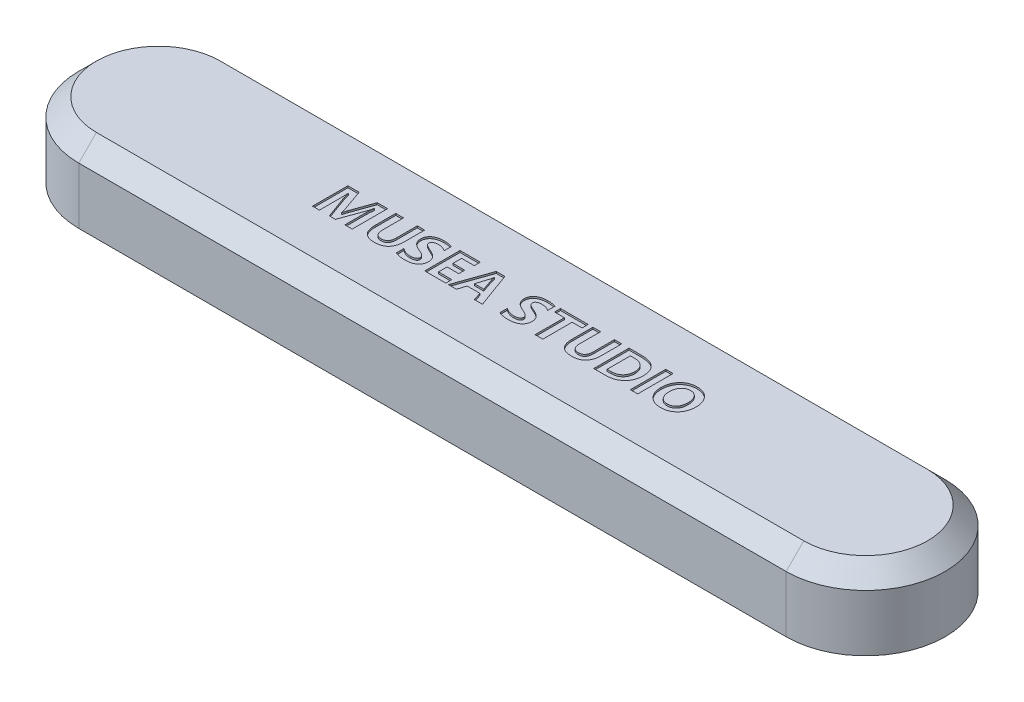
from build123d import *

# Parameters (mm, degrees)
EXTRUDE_1_DEPTH     = 21
CHAMFER_1_SIZE      = 5
SHELL_1_T           = -2.5
CUT_EXTRUDE_2_DEPTH = 1.2
SKETCH_4_R          = 5
EXTRUDE_3_DEPTH     = 17.5
SKETCH_5_R          = 1.6
CUT_EXTRUDE_3_DEPTH = 10
CUT_EXTRUDE_4_DEPTH = 2.4
SKETCH_7_W          = 2.073170732
SKETCH_7_H          = 10
CUT_EXTRUDE_5_DEPTH = 0.5


with BuildPart() as part:
    # 草图1 → 凸台-拉伸1 (new body)
    with BuildSketch(Plane(origin=(0, 0, 0), x_dir=(1, 0, 0), z_dir=(0, 1, 0))):
        with BuildLine():
            ThreePointArc((-77.5, 0), (-84.090097423, 15.909902577), (-100, 22.5))
            Line((-100, 22.5), (-100, -22.5))
            ThreePointArc((-100, -22.5), (-84.090097423, -15.909902577), (-77.5, 0))
        make_face()
        with BuildLine():
            Line((-100, -22.5), (-100, 22.5))
            ThreePointArc((-100, 22.5), (-122.5, 0), (-100, -22.5))
        make_face()
        with BuildLine():
            Line((100, 22.5), (-100, 22.5))
            ThreePointArc((-100, 22.5), (-84.090097423, 15.909902577), (-77.5, 0))
            ThreePointArc((-77.5, 0), (-84.090097423, -15.909902577), (-100, -22.5))
            Line((-100, -22.5), (100, -22.5))
            ThreePointArc((100, -22.5), (77.5, 0), (100, 22.5))
        make_face()
        with BuildLine():
            ThreePointArc((122.5, 0), (115.909902577, 15.909902577), (100, 22.5))
            Line((100, 22.5), (100, -22.5))
            ThreePointArc((100, -22.5), (115.909902577, -15.909902577), (122.5, 0))
        make_face()
        with BuildLine():
            Line((100, -22.5), (100, 22.5))
            ThreePointArc((100, 22.5), (77.5, 0), (100, -22.5))
        make_face()
    extrude(amount=EXTRUDE_1_DEPTH)

    # 倒角1
    chamfer_1_edges = [part.edges().sort_by_distance(p)[0] for p in [
        (0, 21, 22.5),
        (122.5, 21, 0),
        (0, 21, -22.5),
        (-122.5, 21, 0),
    ]]
    chamfer(chamfer_1_edges, length=CHAMFER_1_SIZE)

    # 抽壳1
    shell_1_openings = [part.faces().sort_by_distance(p)[0] for p in [
        (0, 0, 0),
    ]]
    offset(amount=SHELL_1_T, openings=shell_1_openings, kind=Kind.INTERSECTION)

    # 草图2 → 切除-拉伸2 (cut)
    with BuildSketch(Plane.XZ):
        with BuildLine():
            Line((-100, -21.2), (100, -21.2))
            ThreePointArc((100, -21.2), (121.2, 0), (100, 21.2))
            Line((100, 21.2), (-100, 21.2))
            ThreePointArc((-100, 21.2), (-121.2, 0), (-100, -21.2))
        make_face()
        with BuildLine():
            Line((-100, -20), (100, -20))
            ThreePointArc((100, -20), (120, 0), (100, 20))
            Line((100, 20), (-100, 20))
            ThreePointArc((-100, 20), (-120, 0), (-100, -20))
        make_face(mode=Mode.SUBTRACT)
    extrude(amount=-CUT_EXTRUDE_2_DEPTH, mode=Mode.SUBTRACT)

    # 草图4 → 凸台-拉伸3 (add)
    with BuildSketch(Plane.XZ.offset(-18.5)):
        with Locations(Location((-15, 0, 0), (0, 0, 90))):
            Circle(SKETCH_4_R)
    extrude_3 = extrude(amount=EXTRUDE_3_DEPTH)

    # 草图5 → 切除-拉伸3 (cut)
    with BuildSketch(Plane.XZ.offset(-1)):
        with Locations(Location((-15, 0, 0), (0, 0, 270))):
            Circle(SKETCH_5_R)
    cut_extrude_3 = extrude(amount=-CUT_EXTRUDE_3_DEPTH, mode=Mode.SUBTRACT)

    # 草图6 → 切除-拉伸4 (cut)
    with BuildSketch(Plane.XZ.offset(-1)):
        Polygon((-13.41228676, -2.75), (-11.824573519, 0), (-13.41228676, 2.75), (-16.58771324, 2.75), (-18.175426481, 0), (-16.58771324, -2.75), align=None)
    cut_extrude_4 = extrude(amount=-CUT_EXTRUDE_4_DEPTH, mode=Mode.SUBTRACT)

    # 镜向1: 凸台-拉伸3, 切除-拉伸3, 切除-拉伸4 across plane
    add(extrude_3.mirror(Plane(origin=(0, 0, 0), x_dir=(0, 0, 1), z_dir=(1, 0, 0))))
    add(cut_extrude_3.mirror(Plane(origin=(0, 0, 0), x_dir=(0, 0, 1), z_dir=(1, 0, 0))), mode=Mode.SUBTRACT)
    add(cut_extrude_4.mirror(Plane(origin=(0, 0, 0), x_dir=(0, 0, 1), z_dir=(1, 0, 0))), mode=Mode.SUBTRACT)

    # 草图7 → 切除-拉伸5 (cut)
    # profile 1 of 11: a face of its own
    with BuildSketch(Plane(origin=(0, 21, 0), x_dir=(1, 0, 0), z_dir=(0, 1, 0))):
        with BuildLine():
            add(Edge.make_bspline(
                [(42.256097561, -0.127667683), (42.259749856, 0.061814138), (42.266905329, 0.433041649), (42.333957619, 0.976034675), (42.439013879, 1.493063365), (42.59012681, 1.982386617), (42.782871829, 2.445125951), (43.020775656, 2.879390033), (43.300167685, 3.288002832), (43.621581842, 3.665187503), (43.976353468, 4.008421608), (44.362684535, 4.307410381), (44.778168763, 4.558595743), (45.220077779, 4.765245066), (45.689742506, 4.925719877), (46.18649449, 5.039497786), (46.71102865, 5.109609018), (47.070406662, 5.117775098), (47.254192073, 5.12195122)],
                knots=[0, 0, 0, 0, 1.114768385, 2.184023191, 3.214842008, 4.216375225, 5.193220596, 6.16016609, 7.125520499, 8.10150713, 9.071799814, 10.025905719, 10.970272928, 11.923536258, 12.891752738, 13.885610077, 14.918703956, 16, 16, 16, 16], degree=3))
            add(Edge.make_bspline(
                [(47.254192073, 5.12195122), (47.428416773, 5.117379621), (47.769841981, 5.108420736), (48.269216335, 5.043499514), (48.742199496, 4.932853645), (49.189974707, 4.778439305), (49.610269161, 4.576863579), (50.006408474, 4.334078703), (50.373713776, 4.04399496), (50.711270414, 3.712433641), (51.017308469, 3.348686487), (51.283386047, 2.955510209), (51.509736704, 2.537615937), (51.694901814, 2.093997687), (51.83818766, 1.624799963), (51.937859146, 1.13081746), (52.000498199, 0.611999646), (52.008239143, 0.257423987), (52.012195122, 0.076219512)],
                knots=[0, 0, 0, 0, 1.072352965, 2.101472042, 3.093497841, 4.057995957, 5.011133745, 5.957349481, 6.91241005, 7.885665393, 8.865378779, 9.833799821, 10.803025627, 11.786228153, 12.788045293, 13.817877169, 14.884834838, 16, 16, 16, 16], degree=3))
            add(Edge.make_bspline(
                [(52.012195122, 0.076219512), (52.008619575, -0.112639747), (52.001626822, -0.481994809), (51.933776686, -1.021556354), (51.831565081, -1.534389264), (51.681621775, -2.020005313), (51.48932019, -2.478547788), (51.25332629, -2.909950675), (50.976131456, -3.313889066), (50.658258913, -3.686351347), (50.306773259, -4.023165742), (49.926179342, -4.318761648), (49.518151304, -4.567527994), (49.083581685, -4.771030507), (48.622978311, -4.929265444), (48.135762405, -5.041355834), (47.622589019, -5.109040274), (47.271550368, -5.117585812), (47.09222561, -5.12195122)],
                knots=[0, 0, 0, 0, 1.125525784, 2.201208718, 3.237291209, 4.239916505, 5.226012927, 6.197109501, 7.166668921, 8.141825765, 9.111444352, 10.064375446, 11.00938735, 11.954725487, 12.920015397, 13.907536101, 14.931084707, 16, 16, 16, 16], degree=3))
            add(Edge.make_bspline(
                [(47.09222561, -5.12195122), (46.917319123, -5.118440561), (46.573798537, -5.111545542), (46.071976172, -5.042156114), (45.594695604, -4.935317338), (45.143384136, -4.781286219), (44.716693783, -4.585222057), (44.315797995, -4.343017486), (43.940405834, -4.057264383), (43.593516908, -3.730510341), (43.279885543, -3.369905229), (43.006323556, -2.980546317), (42.771330118, -2.567481768), (42.583584167, -2.127017195), (42.435499727, -1.662636277), (42.331990668, -1.173049545), (42.267468695, -0.658484724), (42.259938743, -0.30697829), (42.256097561, -0.127667683)],
                knots=[0, 0, 0, 0, 1.074367157, 2.110083177, 3.10723923, 4.076300727, 5.035189706, 5.987852663, 6.948956014, 7.929336404, 8.911673334, 9.88099426, 10.849387208, 11.826872217, 12.818227126, 13.84036962, 14.89832846, 16, 16, 16, 16], degree=3))
        make_face()
        with BuildLine():
            add(Edge.make_bspline(
                [(44.451219512, -0.013338415), (44.453563652, -0.130905921), (44.458159699, -0.361415171), (44.489788102, -0.699261852), (44.547488092, -1.020100129), (44.625869995, -1.324521887), (44.723597269, -1.613847817), (44.848732811, -1.884747151), (44.99401803, -2.140297887), (45.16087021, -2.377263176), (45.345920544, -2.593290374), (45.552327996, -2.779594519), (45.773925653, -2.938469788), (46.011881655, -3.070110786), (46.268254932, -3.168411034), (46.539990783, -3.241938647), (46.829279947, -3.283269223), (47.02731446, -3.289501009), (47.128429878, -3.292682927)],
                knots=[0, 0, 0, 0, 1.184931797, 2.323241753, 3.415735217, 4.466896578, 5.489261642, 6.489009157, 7.469635635, 8.448254088, 9.405790831, 10.330339266, 11.243447342, 12.148780307, 13.062964896, 14.003988727, 14.980846772, 16, 16, 16, 16], degree=3))
            add(Edge.make_bspline(
                [(47.128429878, -3.292682927), (47.231485131, -3.290440285), (47.432779718, -3.286059803), (47.725738936, -3.242586114), (48.001286564, -3.174946437), (48.259883771, -3.078870884), (48.500373958, -2.954740078), (48.72399134, -2.803481778), (48.926608242, -2.621402255), (49.11332824, -2.416456549), (49.279136283, -2.186434329), (49.423673803, -1.936714362), (49.546506975, -1.668172257), (49.644889418, -1.380624029), (49.723438699, -1.074925116), (49.777796397, -0.750460673), (49.81050757, -0.407178731), (49.814844425, -0.172203738), (49.817073171, -0.051448171)],
                knots=[0, 0, 0, 0, 1.038721561, 2.028902171, 2.979739093, 3.895937291, 4.804150696, 5.703190911, 6.610748933, 7.544954394, 8.494430894, 9.464599871, 10.450689967, 11.467673243, 12.525730618, 13.630462428, 14.782275302, 16, 16, 16, 16], degree=3))
            add(Edge.make_bspline(
                [(49.817073171, -0.051448171), (49.814854863, 0.074386246), (49.810533812, 0.319499603), (49.777714566, 0.676618674), (49.724716166, 1.013469312), (49.651310607, 1.330552564), (49.55456798, 1.627504218), (49.432981873, 1.902574323), (49.295041279, 2.160149494), (49.132149581, 2.394299833), (48.95232838, 2.606552169), (48.752762906, 2.790900224), (48.535659061, 2.947408548), (48.299154004, 3.072961483), (48.046270476, 3.173101408), (47.775576321, 3.242998967), (47.487415866, 3.286049426), (47.289282871, 3.290431706), (47.1875, 3.292682927)],
                knots=[0, 0, 0, 0, 1.256364881, 2.447278127, 3.577572422, 4.659071335, 5.693985313, 6.690867229, 7.65867568, 8.606938913, 9.533575709, 10.431238956, 11.313033112, 12.198355596, 13.098167223, 14.022717975, 14.984250756, 16, 16, 16, 16], degree=3))
            add(Edge.make_bspline(
                [(47.1875, 3.292682927), (47.083833, 3.289580751), (46.881976323, 3.283540304), (46.5871691, 3.24152036), (46.309798064, 3.169009709), (46.048718824, 3.067684405), (45.804781971, 2.937344753), (45.578407968, 2.777172381), (45.367597568, 2.5902755), (45.178089518, 2.373582521), (45.007048987, 2.136232936), (44.85789683, 1.879597159), (44.731834026, 1.605820831), (44.628912294, 1.31491326), (44.548969637, 1.006946627), (44.492422485, 0.681953199), (44.457402578, 0.339946249), (44.453310899, 0.106158128), (44.451219512, -0.013338415)],
                knots=[0, 0, 0, 0, 1.030008459, 2.005595648, 2.951664227, 3.872901532, 4.782126158, 5.692664187, 6.622487942, 7.574851405, 8.547002697, 9.525586399, 10.519618393, 11.537704223, 12.587858271, 13.677387483, 14.81283889, 16, 16, 16, 16], degree=3))
        make_face(mode=Mode.SUBTRACT)
    # profile 2 of 11: a face of its own
    with BuildSketch(Plane(origin=(0, 21, 0), x_dir=(1, 0, 0), z_dir=(0, 1, 0))):
        with Locations((39.512195122, 0)):
            Rectangle(SKETCH_7_W, SKETCH_7_H)
    # profile 3 of 11: a face of its own
    with BuildSketch(Plane(origin=(0, 21, 0), x_dir=(1, 0, 0), z_dir=(0, 1, 0))):
        with BuildLine():
            Line((28.109756098, -5), (28.109756098, 5))
            Line((28.109756098, 5), (31.564405488, 5))
            add(Edge.make_bspline(
                [(31.564405488, 5), (31.779224787, 4.996568545), (32.196328315, 4.989905867), (32.801301082, 4.932128765), (33.365368327, 4.838377033), (33.887913798, 4.705678564), (34.369008543, 4.534719879), (34.808748257, 4.324381664), (35.207097272, 4.076712171), (35.564125134, 3.790034417), (35.878474052, 3.464132983), (36.150863302, 3.099071513), (36.380714225, 2.695706452), (36.566924998, 2.253856469), (36.714339057, 1.775932654), (36.814904539, 1.259124709), (36.879343226, 0.705392398), (36.88653736, 0.322853051), (36.890243902, 0.125762195)],
                knots=[0, 0, 0, 0, 1.245355435, 2.41804227, 3.519984418, 4.557933807, 5.539963194, 6.475593919, 7.378941698, 8.253776925, 9.123714646, 9.997293137, 10.888061047, 11.80880852, 12.772208707, 13.782665578, 14.857591139, 16, 16, 16, 16], degree=3))
            add(Edge.make_bspline(
                [(36.890243902, 0.125762195), (36.88629931, -0.063129171), (36.878593484, -0.432131579), (36.805294754, -0.970999097), (36.691354006, -1.481698705), (36.525649093, -1.963490365), (36.315667838, -2.417286113), (36.059564063, -2.843282486), (35.753166076, -3.238374149), (35.403613375, -3.602068859), (35.018892011, -3.930515124), (34.603613201, -4.216779805), (34.161509879, -4.460021788), (33.691522675, -4.658543859), (33.193776443, -4.810740443), (32.670470444, -4.921538427), (32.119265072, -4.986466069), (31.743057786, -4.995426966), (31.551067073, -5)],
                knots=[0, 0, 0, 0, 1.088347275, 2.126104409, 3.128909261, 4.100389386, 5.057073615, 6.006520549, 6.959329215, 7.933035493, 8.909615141, 9.870410491, 10.835612017, 11.813522371, 12.806054041, 13.831530361, 14.893359996, 16, 16, 16, 16], degree=3))
            Line((31.551067073, -5), (28.109756098, -5))
        make_face()
        with BuildLine():
            Line((30.182926829, 3.292682927), (30.182926829, -3.292682927))
            Line((30.182926829, -3.292682927), (31.37195122, -3.292682927))
            add(Edge.make_bspline(
                [(31.37195122, -3.292682927), (31.497866278, -3.290617465), (31.74415323, -3.286577469), (32.102171071, -3.240657276), (32.440447, -3.172365255), (32.756274041, -3.069462407), (33.053082937, -2.943165037), (33.328546106, -2.784977082), (33.582158249, -2.598080594), (33.813375614, -2.383284738), (34.021395705, -2.145801871), (34.201358034, -1.884430514), (34.353914361, -1.603116638), (34.480282786, -1.302704642), (34.578192546, -0.981597864), (34.644866508, -0.639918616), (34.688507442, -0.278693645), (34.692883971, -0.031255513), (34.695121951, 0.09527439)],
                knots=[0, 0, 0, 0, 1.124145304, 2.198802305, 3.219247302, 4.202562183, 5.160671572, 6.095979936, 7.033351254, 7.968866118, 8.909888044, 9.847928846, 10.797515988, 11.763839303, 12.754590797, 13.79056581, 14.870184264, 16, 16, 16, 16], degree=3))
            add(Edge.make_bspline(
                [(34.695121951, 0.09527439), (34.691944948, 0.217328507), (34.685737119, 0.455820928), (34.644718169, 0.803227661), (34.571438381, 1.129715851), (34.471601031, 1.436548838), (34.33857318, 1.721287988), (34.180345422, 1.987278203), (33.990007405, 2.230319885), (33.77224266, 2.450815793), (33.532767318, 2.648779382), (33.273579957, 2.820649022), (32.998858594, 2.969026427), (32.704720653, 3.086112878), (32.395381906, 3.181091478), (32.066928639, 3.243969432), (31.722359802, 3.285544664), (31.486407793, 3.290274147), (31.366234756, 3.292682927)],
                knots=[0, 0, 0, 0, 1.123744865, 2.195785287, 3.214438223, 4.200077043, 5.160286279, 6.101994164, 7.043647577, 7.994732033, 8.950121359, 9.898919918, 10.853825915, 11.819202997, 12.808927312, 13.82846947, 14.894014847, 16, 16, 16, 16], degree=3))
            Line((31.366234756, 3.292682927), (30.182926829, 3.292682927))
        make_face(mode=Mode.SUBTRACT)
    # profile 4 of 11: a face of its own
    with BuildSketch(Plane(origin=(0, 21, 0), x_dir=(1, 0, 0), z_dir=(0, 1, 0))):
        with BuildLine():
            add(Edge.make_bspline(
                [(26.036585366, -0.670731707), (26.033142941, -0.850580374), (26.026476472, -1.198868486), (25.979478682, -1.704806378), (25.897637215, -2.175443303), (25.786719543, -2.613064763), (25.640369931, -3.01499607), (25.459540799, -3.381485288), (25.250939669, -3.716432661), (25.004255995, -4.013577803), (24.726806797, -4.277184416), (24.414178981, -4.502759179), (24.071679585, -4.69685834), (23.694874306, -4.852346187), (23.287085841, -4.974981485), (22.846301944, -5.058057629), (22.37438382, -5.113635738), (22.048570484, -5.119123836), (21.880716463, -5.12195122)],
                knots=[0, 0, 0, 0, 1.235970273, 2.393533182, 3.487949003, 4.515992742, 5.492359522, 6.421609714, 7.320200712, 8.197688609, 9.068473492, 9.9433408, 10.840509925, 11.7679436, 12.738791264, 13.761818313, 14.84692321, 16, 16, 16, 16], degree=3))
            add(Edge.make_bspline(
                [(21.880716463, -5.12195122), (21.718598044, -5.118906902), (21.403661968, -5.11299292), (20.947437449, -5.06031343), (20.521692926, -4.97795542), (20.12734281, -4.860332642), (19.764081834, -4.707434778), (19.432802326, -4.520111913), (19.13145475, -4.299428827), (18.86415601, -4.041778715), (18.62550067, -3.752345767), (18.421472469, -3.427780629), (18.248950907, -3.069667364), (18.109322994, -2.677745543), (17.998262445, -2.252599614), (17.922282747, -1.79336893), (17.873350688, -1.30124093), (17.868401781, -0.961760294), (17.865853659, -0.786966463)],
                knots=[0, 0, 0, 0, 1.148060148, 2.23025588, 3.248551608, 4.216496896, 5.139925816, 6.034536378, 6.906548873, 7.778503327, 8.657637241, 9.557628747, 10.487339234, 11.467969992, 12.500363046, 13.595861819, 14.762142881, 16, 16, 16, 16], degree=3))
            Line((17.865853659, -0.786966463), (17.865853659, 5))
            Line((17.865853659, 5), (20.06097561, 5))
            Line((20.06097561, 5), (20.06097561, -0.804115854))
            add(Edge.make_bspline(
                [(20.06097561, -0.804115854), (20.062318209, -0.904523273), (20.064922157, -1.099261638), (20.088380404, -1.381736169), (20.124616548, -1.645143452), (20.181368572, -1.888539885), (20.248313362, -2.11357294), (20.332137022, -2.31970261), (20.43333318, -2.504511284), (20.548725828, -2.671429762), (20.680047473, -2.817902545), (20.826759864, -2.946057412), (20.989981221, -3.052887591), (21.168079153, -3.140515465), (21.361021369, -3.209837362), (21.569303503, -3.259049679), (21.793541703, -3.287512172), (21.947960697, -3.290925904), (22.027439024, -3.292682927)],
                knots=[0, 0, 0, 0, 1.329763638, 2.579052408, 3.752249674, 4.848271385, 5.886243203, 6.859634421, 7.789624459, 8.671882452, 9.541777961, 10.388665663, 11.245070424, 12.11801215, 13.012224324, 13.955027817, 14.947467761, 16, 16, 16, 16], degree=3))
            add(Edge.make_bspline(
                [(22.027439024, -3.292682927), (22.105671403, -3.291034052), (22.25760659, -3.287831769), (22.477458651, -3.257958068), (22.683742971, -3.213734711), (22.873839024, -3.146523323), (23.049756451, -3.062713633), (23.209220833, -2.958176651), (23.355317032, -2.836683612), (23.482781196, -2.693035425), (23.598905231, -2.534834282), (23.695812956, -2.35452469), (23.779100053, -2.156700081), (23.848086539, -1.940652277), (23.898417228, -1.705594269), (23.936464894, -1.452371201), (23.959308855, -1.17991397), (23.962019899, -0.992167915), (23.963414634, -0.895579268)],
                knots=[0, 0, 0, 0, 1.06525563, 2.068834107, 3.017760966, 3.934579473, 4.809264905, 5.666133045, 6.525923798, 7.389754923, 8.276006946, 9.193845841, 10.171036594, 11.197302887, 12.278570952, 13.442422199, 14.684217483, 16, 16, 16, 16], degree=3))
            Line((23.963414634, -0.895579268), (23.963414634, 5))
            Line((23.963414634, 5), (26.036585366, 5))
            Line((26.036585366, 5), (26.036585366, -0.670731707))
        make_face()
    # profile 5 of 11: a face of its own
    with BuildSketch(Plane(origin=(0, 21, 0), x_dir=(1, 0, 0), z_dir=(0, 1, 0))):
        Polygon((16.524390244, 3.292682927), (13.719512195, 3.292682927), (13.719512195, -5), (11.524390244, -5), (11.524390244, 3.292682927), (8.719512195, 3.292682927), (8.719512195, 5), (16.524390244, 5), align=None)
    # profile 6 of 11: a face of its own
    with BuildSketch(Plane(origin=(0, 21, 0), x_dir=(1, 0, 0), z_dir=(0, 1, 0))):
        with BuildLine():
            add(Edge.make_bspline(
                [(1.158536585, -2.43902439), (1.260170038, -2.517034946), (1.46098301, -2.671172497), (1.781160224, -2.86891965), (2.110567373, -3.038833326), (2.451689231, -3.175076464), (2.8026791, -3.283215213), (3.163700036, -3.358714257), (3.535317627, -3.406184143), (3.786695775, -3.411795349), (3.913871951, -3.414634146)],
                knots=[0, 0, 0, 0, 1.030769735, 2.036651588, 3.024478373, 4.01094135, 4.989422027, 5.977156186, 6.976611362, 8, 8, 8, 8], degree=3))
            add(Edge.make_bspline(
                [(3.913871951, -3.414634146), (3.98441477, -3.414331315), (4.121236261, -3.413743959), (4.319510571, -3.397015062), (4.504836096, -3.375408618), (4.676711221, -3.342926438), (4.835102635, -3.302069796), (4.979015904, -3.249159899), (5.111506142, -3.192138761), (5.228233668, -3.120588729), (5.330522795, -3.041469268), (5.42363978, -2.961590117), (5.498060293, -2.871209927), (5.56262064, -2.778683266), (5.609373745, -2.677503696), (5.647386655, -2.5735266), (5.665389738, -2.462491813), (5.668928434, -2.387620118), (5.670731707, -2.349466463)],
                knots=[0, 0, 0, 0, 1.476865867, 2.864458665, 4.164680569, 5.383116469, 6.525388929, 7.585792532, 8.59207873, 9.541166726, 10.443121665, 11.300413239, 12.102680814, 12.888568172, 13.656114303, 14.430203606, 15.20005192, 16, 16, 16, 16], degree=3))
            add(Edge.make_bspline(
                [(5.670731707, -2.349466463), (5.666880709, -2.282230384), (5.659142433, -2.1471248), (5.58879806, -1.949404882), (5.477530325, -1.759341799), (5.350413242, -1.604882413), (5.212070291, -1.483386486), (5.071664082, -1.380094415), (4.894254877, -1.272220748), (4.683342424, -1.152619535), (4.435717467, -1.028732631), (4.153183493, -0.894916586), (3.83432523, -0.754508537), (3.609133213, -0.659603757), (3.490853659, -0.609756098)],
                knots=[0, 0, 0, 0, 0.819499822, 1.646720071, 2.533456601, 3.503462207, 4.075242574, 4.780073049, 5.63084876, 6.610988475, 7.742685345, 9.013520291, 10.431385378, 12, 12, 12, 12], degree=3))
            add(Edge.make_bspline(
                [(3.490853659, -0.609756098), (3.396406543, -0.568789084), (3.211253143, -0.488477665), (2.94720261, -0.354568452), (2.700111021, -0.216270153), (2.473201765, -0.068606759), (2.262428393, 0.083597029), (2.069598801, 0.243408823), (1.89528363, 0.411234668), (1.740946807, 0.587394119), (1.603053038, 0.768219635), (1.483104232, 0.956242002), (1.384881102, 1.153016173), (1.302575583, 1.355569148), (1.236481318, 1.56489496), (1.191728254, 1.781349613), (1.164172967, 2.005133291), (1.160437678, 2.15629648), (1.158536585, 2.233231707)],
                knots=[0, 0, 0, 0, 1.260011122, 2.470116114, 3.622619066, 4.724708874, 5.782288028, 6.803720517, 7.788017234, 8.741107992, 9.667956542, 10.569643666, 11.466793506, 12.356227822, 13.244029273, 14.149863952, 15.058364424, 16, 16, 16, 16], degree=3))
            add(Edge.make_bspline(
                [(1.158536585, 2.233231707), (1.16202336, 2.344543173), (1.168830797, 2.561863185), (1.216323666, 2.878705409), (1.298762176, 3.175996154), (1.412913005, 3.454356783), (1.562093928, 3.712261628), (1.741393689, 3.952028097), (1.956340338, 4.170237633), (2.199691407, 4.370592253), (2.472507646, 4.54543302), (2.765865976, 4.70147755), (3.080531692, 4.832228229), (3.416350139, 4.939696367), (3.773610846, 5.020511081), (4.151165483, 5.078779866), (4.54954508, 5.116397186), (4.822066624, 5.120067882), (4.961890244, 5.12195122)],
                knots=[0, 0, 0, 0, 0.993150266, 1.938986485, 2.850651161, 3.74003956, 4.615962627, 5.50238446, 6.404182862, 7.342500621, 8.309296766, 9.290472304, 10.304111293, 11.345495511, 12.433005957, 13.568872287, 14.752652457, 16, 16, 16, 16], degree=3))
            add(Edge.make_bspline(
                [(4.961890244, 5.12195122), (5.079424145, 5.121066979), (5.310208148, 5.119330726), (5.648969304, 5.09941432), (5.973151499, 5.069305638), (6.283005951, 5.028074383), (6.577915409, 4.972501646), (6.858763102, 4.906590675), (7.124683559, 4.826667046), (7.294535206, 4.762752211), (7.37804878, 4.73132622)],
                knots=[0, 0, 0, 0, 1.145656801, 2.249557455, 3.306836647, 4.319135969, 5.295538011, 6.231195101, 7.130304458, 8, 8, 8, 8], degree=3))
            Line((7.37804878, 4.73132622), (7.37804878, 2.682926829))
            add(Edge.make_bspline(
                [(7.37804878, 2.682926829), (7.294503329, 2.741531817), (7.128490056, 2.857985863), (6.863562146, 3.006715936), (6.588784874, 3.132589693), (6.302831673, 3.236561666), (6.006175949, 3.3157281), (5.699199091, 3.373158167), (5.381919313, 3.408298731), (5.166502891, 3.412501142), (5.057164634, 3.414634146)],
                knots=[0, 0, 0, 0, 0.988687099, 1.96462139, 2.939856337, 3.915576993, 4.910207716, 5.91243115, 6.940419046, 8, 8, 8, 8], degree=3))
            add(Edge.make_bspline(
                [(5.057164634, 3.414634146), (4.934390582, 3.411647377), (4.700353853, 3.40595388), (4.367728345, 3.355125327), (4.073254043, 3.268729665), (3.857257616, 3.165436888), (3.708980934, 3.067721814), (3.614775072, 2.988723694), (3.533662693, 2.905240526), (3.46848578, 2.814296312), (3.415483906, 2.718259075), (3.379890323, 2.615077689), (3.358134088, 2.505988751), (3.355176155, 2.431506889), (3.353658537, 2.393292683)],
                knots=[0, 0, 0, 0, 2.003433986, 3.819024695, 5.475667647, 6.996800601, 7.707148858, 8.369643762, 9.000378722, 9.6018828, 10.191106307, 10.784693145, 11.376465838, 12, 12, 12, 12], degree=3))
            add(Edge.make_bspline(
                [(3.353658537, 2.393292683), (3.357969901, 2.331857519), (3.366612901, 2.20869836), (3.42938273, 2.028183917), (3.533437849, 1.857449363), (3.651434907, 1.721075847), (3.77718326, 1.613940907), (3.903279988, 1.525556169), (4.058681058, 1.430925714), (4.242331523, 1.327923387), (4.455610682, 1.217446925), (4.69991311, 1.102550767), (4.97189064, 0.978083161), (5.164295389, 0.896369294), (5.264862805, 0.853658537)],
                knots=[0, 0, 0, 0, 0.853033172, 1.710076779, 2.624531279, 3.619435328, 4.201614876, 4.916900679, 5.757231526, 6.729594562, 7.843042798, 9.094783227, 10.481481646, 12, 12, 12, 12], degree=3))
            add(Edge.make_bspline(
                [(5.264862805, 0.853658537), (5.384827611, 0.801493041), (5.616827588, 0.700610173), (5.944105666, 0.535053096), (6.245013104, 0.372447951), (6.51550299, 0.205209995), (6.756634321, 0.035275142), (6.970042119, -0.135791534), (7.152701202, -0.311310901), (7.310719504, -0.487878787), (7.440457102, -0.672798364), (7.556765748, -0.861030666), (7.651753629, -1.060792021), (7.729955195, -1.268661847), (7.790861497, -1.484792794), (7.835433587, -1.708940274), (7.85947029, -1.941802293), (7.863706523, -2.099797933), (7.865853659, -2.179878049)],
                knots=[0, 0, 0, 0, 1.466284168, 2.835647424, 4.110369053, 5.29996527, 6.398455812, 7.416047896, 8.362887352, 9.235743062, 10.067670856, 10.892006009, 11.713722703, 12.542994866, 13.379299658, 14.228391116, 15.102059757, 16, 16, 16, 16], degree=3))
            add(Edge.make_bspline(
                [(7.865853659, -2.179878049), (7.863271285, -2.296288044), (7.858252549, -2.522526052), (7.809338039, -2.851592165), (7.729933687, -3.159065243), (7.619097378, -3.446215757), (7.475062702, -3.711393151), (7.298807124, -3.954678909), (7.089975991, -4.175988619), (6.851254153, -4.375760515), (6.583138734, -4.554009067), (6.286140131, -4.705095836), (5.964553472, -4.835762231), (5.615254124, -4.93972175), (5.239343843, -5.021127537), (4.836930002, -5.079002459), (4.408103672, -5.116494899), (4.113396147, -5.120095522), (3.961509146, -5.12195122)],
                knots=[0, 0, 0, 0, 1.007208364, 1.957467766, 2.872372571, 3.751550028, 4.615183403, 5.477485416, 6.344961217, 7.24260133, 8.16677839, 9.125889537, 10.122460229, 11.16790667, 12.276638845, 13.449302383, 14.685415952, 16, 16, 16, 16], degree=3))
            add(Edge.make_bspline(
                [(3.961509146, -5.12195122), (3.822377735, -5.119841405), (3.550245996, -5.115714749), (3.151399244, -5.091704034), (2.771711029, -5.047918401), (2.411289458, -4.986555865), (2.068905887, -4.911873781), (1.747025524, -4.816188228), (1.443414891, -4.70452749), (1.25256349, -4.613973205), (1.158536585, -4.569359756)],
                knots=[0, 0, 0, 0, 1.158594145, 2.266132699, 3.325651419, 4.339500193, 5.30958232, 6.241723665, 7.133748659, 8, 8, 8, 8], degree=3))
            Line((1.158536585, -4.569359756), (1.158536585, -2.43902439))
        make_face()
    # profile 7 of 11: a face of its own
    with BuildSketch(Plane(origin=(0, 21, 0), x_dir=(1, 0, 0), z_dir=(0, 1, 0))):
        Polygon((-3.353658537, -5), (-5.645960366, -5), (-6.383384146, -2.682926829), (-9.98285061, -2.682926829), (-10.708841463, -5), (-12.987804878, -5), (-9.451219512, 5), (-7.012195122, 5), align=None)
        with BuildLine():
            Line((-6.886432927, -1.097560976), (-8.077362805, 2.410442073))
            add(Edge.make_bspline(
                [(-8.077362805, 2.410442073), (-8.094545418, 2.470608831), (-8.130991578, 2.598228957), (-8.174734788, 2.805525593), (-8.207996021, 3.039874975), (-8.223538535, 3.205588019), (-8.231707317, 3.292682927)],
                knots=[0, 0, 0, 0, 0.836572256, 1.774459205, 2.830307706, 4, 4, 4, 4], degree=3))
            add(Edge.make_bspline(
                [(-8.231707317, 3.292682927), (-8.247869352, 3.146403329), (-8.27991657, 2.856349873), (-8.361069702, 2.576055415), (-8.401295732, 2.437118902)],
                knots=[0, 0, 0, 0, 1.008638885, 2, 2, 2, 2], degree=3))
            Line((-8.401295732, 2.437118902), (-9.519817073, -1.097560976))
            Line((-9.519817073, -1.097560976), (-6.886432927, -1.097560976))
        make_face(mode=Mode.SUBTRACT)
    # profile 8 of 11: a face of its own
    with BuildSketch(Plane(origin=(0, 21, 0), x_dir=(1, 0, 0), z_dir=(0, 1, 0))):
        Polygon((-13.719512195, -5), (-19.695121951, -5), (-19.695121951, 5), (-13.963414634, 5), (-13.963414634, 3.292682927), (-17.54382622, 3.292682927), (-17.54382622, 0.853658537), (-14.207317073, 0.853658537), (-14.207317073, -0.853658537), (-17.5, -0.853658537), (-17.5, -3.292682927), (-13.719512195, -3.292682927), align=None)
    # profile 9 of 11: a face of its own
    with BuildSketch(Plane(origin=(0, 21, 0), x_dir=(1, 0, 0), z_dir=(0, 1, 0))):
        with BuildLine():
            add(Edge.make_bspline(
                [(-28.109756098, -2.43902439), (-28.008122645, -2.517034946), (-27.807309673, -2.671172497), (-27.487132459, -2.86891965), (-27.157725309, -3.038833326), (-26.816603451, -3.175076464), (-26.465613583, -3.283215213), (-26.104592647, -3.358714257), (-25.732975056, -3.406184143), (-25.481596908, -3.411795349), (-25.354420732, -3.414634146)],
                knots=[0, 0, 0, 0, 1.030769735, 2.036651588, 3.024478373, 4.01094135, 4.989422027, 5.977156186, 6.976611362, 8, 8, 8, 8], degree=3))
            add(Edge.make_bspline(
                [(-25.354420732, -3.414634146), (-25.283877913, -3.414331315), (-25.147056422, -3.413743959), (-24.948782112, -3.397015062), (-24.763456587, -3.375408618), (-24.591581462, -3.342926438), (-24.433190048, -3.302069796), (-24.289276779, -3.249159899), (-24.156786541, -3.192138761), (-24.040059015, -3.120588729), (-23.937769888, -3.041469268), (-23.844652903, -2.961590117), (-23.77023239, -2.871209927), (-23.705672043, -2.778683266), (-23.658918938, -2.677503696), (-23.620906028, -2.5735266), (-23.602902945, -2.462491813), (-23.599364249, -2.387620118), (-23.597560976, -2.349466463)],
                knots=[0, 0, 0, 0, 1.476865867, 2.864458665, 4.164680569, 5.383116469, 6.525388929, 7.585792532, 8.59207873, 9.541166726, 10.443121665, 11.300413239, 12.102680814, 12.888568172, 13.656114303, 14.430203606, 15.20005192, 16, 16, 16, 16], degree=3))
            add(Edge.make_bspline(
                [(-23.597560976, -2.349466463), (-23.601411974, -2.282230384), (-23.60915025, -2.1471248), (-23.679494623, -1.949404882), (-23.790762358, -1.759341799), (-23.917879441, -1.604882413), (-24.056222392, -1.483386486), (-24.196628601, -1.380094415), (-24.374037806, -1.272220748), (-24.584950259, -1.152619535), (-24.832575216, -1.028732631), (-25.11510919, -0.894916586), (-25.433967453, -0.754508537), (-25.65915947, -0.659603757), (-25.777439024, -0.609756098)],
                knots=[0, 0, 0, 0, 0.819499822, 1.646720071, 2.533456601, 3.503462207, 4.075242574, 4.780073049, 5.63084876, 6.610988475, 7.742685345, 9.013520291, 10.431385378, 12, 12, 12, 12], degree=3))
            add(Edge.make_bspline(
                [(-25.777439024, -0.609756098), (-25.87188614, -0.568789084), (-26.05703954, -0.488477665), (-26.321090073, -0.354568452), (-26.568181662, -0.216270153), (-26.795090918, -0.068606759), (-27.00586429, 0.083597029), (-27.198693882, 0.243408823), (-27.373009053, 0.411234668), (-27.527345876, 0.587394119), (-27.665239644, 0.768219635), (-27.785188451, 0.956242002), (-27.88341158, 1.153016173), (-27.9657171, 1.355569148), (-28.031811365, 1.56489496), (-28.076564429, 1.781349613), (-28.104119716, 2.005133291), (-28.107855005, 2.15629648), (-28.109756098, 2.233231707)],
                knots=[0, 0, 0, 0, 1.260011122, 2.470116114, 3.622619066, 4.724708874, 5.782288028, 6.803720517, 7.788017234, 8.741107992, 9.667956542, 10.569643666, 11.466793506, 12.356227822, 13.244029273, 14.149863952, 15.058364424, 16, 16, 16, 16], degree=3))
            add(Edge.make_bspline(
                [(-28.109756098, 2.233231707), (-28.106269323, 2.344543173), (-28.099461886, 2.561863185), (-28.051969017, 2.878705409), (-27.969530507, 3.175996154), (-27.855379678, 3.454356783), (-27.706198755, 3.712261628), (-27.526898994, 3.952028097), (-27.311952345, 4.170237633), (-27.068601276, 4.370592253), (-26.795785037, 4.54543302), (-26.502426707, 4.70147755), (-26.187760991, 4.832228229), (-25.851942544, 4.939696367), (-25.494681837, 5.020511081), (-25.1171272, 5.078779866), (-24.718747603, 5.116397186), (-24.446226059, 5.120067882), (-24.306402439, 5.12195122)],
                knots=[0, 0, 0, 0, 0.993150266, 1.938986485, 2.850651161, 3.74003956, 4.615962627, 5.50238446, 6.404182862, 7.342500621, 8.309296766, 9.290472304, 10.304111293, 11.345495511, 12.433005957, 13.568872287, 14.752652457, 16, 16, 16, 16], degree=3))
            add(Edge.make_bspline(
                [(-24.306402439, 5.12195122), (-24.188868538, 5.121066979), (-23.958084535, 5.119330726), (-23.619323379, 5.09941432), (-23.295141184, 5.069305638), (-22.985286732, 5.028074383), (-22.690377274, 4.972501646), (-22.409529581, 4.906590675), (-22.143609124, 4.826667046), (-21.973757477, 4.762752211), (-21.890243902, 4.73132622)],
                knots=[0, 0, 0, 0, 1.145656801, 2.249557455, 3.306836647, 4.319135969, 5.295538011, 6.231195101, 7.130304458, 8, 8, 8, 8], degree=3))
            Line((-21.890243902, 4.73132622), (-21.890243902, 2.682926829))
            add(Edge.make_bspline(
                [(-21.890243902, 2.682926829), (-21.973789354, 2.741531817), (-22.139802627, 2.857985863), (-22.404730537, 3.006715936), (-22.679507809, 3.132589693), (-22.96546101, 3.236561666), (-23.262116734, 3.3157281), (-23.569093592, 3.373158167), (-23.88637337, 3.408298731), (-24.101789792, 3.412501142), (-24.211128049, 3.414634146)],
                knots=[0, 0, 0, 0, 0.988687099, 1.96462139, 2.939856337, 3.915576993, 4.910207716, 5.91243115, 6.940419046, 8, 8, 8, 8], degree=3))
            add(Edge.make_bspline(
                [(-24.211128049, 3.414634146), (-24.333902101, 3.411647377), (-24.56793883, 3.40595388), (-24.900564338, 3.355125327), (-25.19503864, 3.268729665), (-25.411035067, 3.165436888), (-25.559311749, 3.067721814), (-25.65351761, 2.988723694), (-25.73462999, 2.905240526), (-25.799806903, 2.814296312), (-25.852808777, 2.718259075), (-25.88840236, 2.615077689), (-25.910158595, 2.505988751), (-25.913116528, 2.431506889), (-25.914634146, 2.393292683)],
                knots=[0, 0, 0, 0, 2.003433986, 3.819024695, 5.475667647, 6.996800601, 7.707148858, 8.369643762, 9.000378722, 9.6018828, 10.191106307, 10.784693145, 11.376465838, 12, 12, 12, 12], degree=3))
            add(Edge.make_bspline(
                [(-25.914634146, 2.393292683), (-25.910322781, 2.331857519), (-25.901679782, 2.20869836), (-25.838909953, 2.028183917), (-25.734854834, 1.857449363), (-25.616857776, 1.721075847), (-25.491109423, 1.613940907), (-25.365012695, 1.525556169), (-25.209611625, 1.430925714), (-25.02596116, 1.327923387), (-24.812682001, 1.217446925), (-24.568379573, 1.102550767), (-24.296402043, 0.978083161), (-24.103997294, 0.896369294), (-24.003429878, 0.853658537)],
                knots=[0, 0, 0, 0, 0.853033172, 1.710076779, 2.624531279, 3.619435328, 4.201614876, 4.916900679, 5.757231526, 6.729594562, 7.843042798, 9.094783227, 10.481481646, 12, 12, 12, 12], degree=3))
            add(Edge.make_bspline(
                [(-24.003429878, 0.853658537), (-23.883465072, 0.801493041), (-23.651465095, 0.700610173), (-23.324187017, 0.535053096), (-23.023279579, 0.372447951), (-22.752789693, 0.205209995), (-22.511658362, 0.035275142), (-22.298250564, -0.135791534), (-22.115591481, -0.311310901), (-21.957573179, -0.487878787), (-21.827835581, -0.672798364), (-21.711526935, -0.861030666), (-21.616539053, -1.060792021), (-21.538337488, -1.268661847), (-21.477431186, -1.484792794), (-21.432859095, -1.708940274), (-21.408822393, -1.941802293), (-21.40458616, -2.099797933), (-21.402439024, -2.179878049)],
                knots=[0, 0, 0, 0, 1.466284168, 2.835647424, 4.110369053, 5.29996527, 6.398455812, 7.416047896, 8.362887352, 9.235743062, 10.067670856, 10.892006009, 11.713722703, 12.542994866, 13.379299658, 14.228391116, 15.102059757, 16, 16, 16, 16], degree=3))
            add(Edge.make_bspline(
                [(-21.402439024, -2.179878049), (-21.405021398, -2.296288044), (-21.410040134, -2.522526052), (-21.458954644, -2.851592165), (-21.538358996, -3.159065243), (-21.649195305, -3.446215757), (-21.793229981, -3.711393151), (-21.969485559, -3.954678909), (-22.178316692, -4.175988619), (-22.41703853, -4.375760515), (-22.685153949, -4.554009067), (-22.982152552, -4.705095836), (-23.303739211, -4.835762231), (-23.653038559, -4.93972175), (-24.028948839, -5.021127537), (-24.431362681, -5.079002459), (-24.860189011, -5.116494899), (-25.154896536, -5.120095522), (-25.306783537, -5.12195122)],
                knots=[0, 0, 0, 0, 1.007208364, 1.957467766, 2.872372571, 3.751550028, 4.615183403, 5.477485416, 6.344961217, 7.24260133, 8.16677839, 9.125889537, 10.122460229, 11.16790667, 12.276638845, 13.449302383, 14.685415952, 16, 16, 16, 16], degree=3))
            add(Edge.make_bspline(
                [(-25.306783537, -5.12195122), (-25.445914948, -5.119841405), (-25.718046687, -5.115714749), (-26.116893438, -5.091704034), (-26.496581654, -5.047918401), (-26.857003225, -4.986555865), (-27.199386796, -4.911873781), (-27.521267159, -4.816188228), (-27.824877792, -4.70452749), (-28.015729193, -4.613973205), (-28.109756098, -4.569359756)],
                knots=[0, 0, 0, 0, 1.158594145, 2.266132699, 3.325651419, 4.339500193, 5.30958232, 6.241723665, 7.133748659, 8, 8, 8, 8], degree=3))
            Line((-28.109756098, -4.569359756), (-28.109756098, -2.43902439))
        make_face()
    # profile 10 of 11: a face of its own
    with BuildSketch(Plane(origin=(0, 21, 0), x_dir=(1, 0, 0), z_dir=(0, 1, 0))):
        with BuildLine():
            add(Edge.make_bspline(
                [(-29.695121951, -0.670731707), (-29.698564376, -0.850580374), (-29.705230845, -1.198868486), (-29.752228635, -1.704806378), (-29.834070103, -2.175443303), (-29.944987774, -2.613064763), (-30.091337386, -3.01499607), (-30.272166518, -3.381485288), (-30.480767649, -3.716432661), (-30.727451323, -4.013577803), (-31.00490052, -4.277184416), (-31.317528336, -4.502759179), (-31.660027732, -4.69685834), (-32.036833011, -4.852346187), (-32.444621476, -4.974981485), (-32.885405373, -5.058057629), (-33.357323497, -5.113635738), (-33.683136833, -5.119123836), (-33.850990854, -5.12195122)],
                knots=[0, 0, 0, 0, 1.235970273, 2.393533182, 3.487949003, 4.515992742, 5.492359522, 6.421609714, 7.320200712, 8.197688609, 9.068473492, 9.9433408, 10.840509925, 11.7679436, 12.738791264, 13.761818313, 14.84692321, 16, 16, 16, 16], degree=3))
            add(Edge.make_bspline(
                [(-33.850990854, -5.12195122), (-34.013109273, -5.118906902), (-34.328045349, -5.11299292), (-34.784269868, -5.06031343), (-35.210014391, -4.97795542), (-35.604364507, -4.860332642), (-35.967625483, -4.707434778), (-36.298904991, -4.520111913), (-36.600252567, -4.299428827), (-36.867551307, -4.041778715), (-37.106206648, -3.752345767), (-37.310234848, -3.427780629), (-37.48275641, -3.069667364), (-37.622384323, -2.677745543), (-37.733444872, -2.252599614), (-37.80942457, -1.79336893), (-37.858356629, -1.30124093), (-37.863305536, -0.961760294), (-37.865853659, -0.786966463)],
                knots=[0, 0, 0, 0, 1.148060148, 2.23025588, 3.248551608, 4.216496896, 5.139925816, 6.034536378, 6.906548873, 7.778503327, 8.657637241, 9.557628747, 10.487339234, 11.467969992, 12.500363046, 13.595861819, 14.762142881, 16, 16, 16, 16], degree=3))
            Line((-37.865853659, -0.786966463), (-37.865853659, 5))
            Line((-37.865853659, 5), (-35.670731707, 5))
            Line((-35.670731707, 5), (-35.670731707, -0.804115854))
            add(Edge.make_bspline(
                [(-35.670731707, -0.804115854), (-35.669389108, -0.904523273), (-35.66678516, -1.099261638), (-35.643326913, -1.381736169), (-35.607090769, -1.645143452), (-35.550338745, -1.888539885), (-35.483393956, -2.11357294), (-35.399570295, -2.31970261), (-35.298374137, -2.504511284), (-35.182981489, -2.671429762), (-35.051659844, -2.817902545), (-34.904947453, -2.946057412), (-34.741726096, -3.052887591), (-34.563628164, -3.140515465), (-34.370685948, -3.209837362), (-34.162403814, -3.259049679), (-33.938165614, -3.287512172), (-33.78374662, -3.290925904), (-33.704268293, -3.292682927)],
                knots=[0, 0, 0, 0, 1.329763638, 2.579052408, 3.752249674, 4.848271385, 5.886243203, 6.859634421, 7.789624459, 8.671882452, 9.541777961, 10.388665663, 11.245070424, 12.11801215, 13.012224324, 13.955027817, 14.947467761, 16, 16, 16, 16], degree=3))
            add(Edge.make_bspline(
                [(-33.704268293, -3.292682927), (-33.626035914, -3.291034052), (-33.474100727, -3.287831769), (-33.254248666, -3.257958068), (-33.047964346, -3.213734711), (-32.857868293, -3.146523323), (-32.681950866, -3.062713633), (-32.522486484, -2.958176651), (-32.376390285, -2.836683612), (-32.248926121, -2.693035425), (-32.132802086, -2.534834282), (-32.035894361, -2.35452469), (-31.952607264, -2.156700081), (-31.883620778, -1.940652277), (-31.833290089, -1.705594269), (-31.795242423, -1.452371201), (-31.772398462, -1.17991397), (-31.769687418, -0.992167915), (-31.768292683, -0.895579268)],
                knots=[0, 0, 0, 0, 1.06525563, 2.068834107, 3.017760966, 3.934579473, 4.809264905, 5.666133045, 6.525923798, 7.389754923, 8.276006946, 9.193845841, 10.171036594, 11.197302887, 12.278570952, 13.442422199, 14.684217483, 16, 16, 16, 16], degree=3))
            Line((-31.768292683, -0.895579268), (-31.768292683, 5))
            Line((-31.768292683, 5), (-29.695121951, 5))
            Line((-29.695121951, 5), (-29.695121951, -0.670731707))
        make_face()
    # profile 11 of 11: a face of its own
    with BuildSketch(Plane(origin=(0, 21, 0), x_dir=(1, 0, 0), z_dir=(0, 1, 0))):
        with BuildLine():
            Line((-42.256097561, -5), (-42.256097561, 1.061356707))
            add(Edge.make_bspline(
                [(-42.256097561, 1.061356707), (-42.256038656, 1.133778964), (-42.255917694, 1.282498386), (-42.244448655, 1.512383794), (-42.232038915, 1.75574995), (-42.212746612, 2.01303563), (-42.18712042, 2.283491234), (-42.159870109, 2.567715397), (-42.122265531, 2.864692245), (-42.096082595, 3.067207947), (-42.082698171, 3.170731707)],
                knots=[0, 0, 0, 0, 0.820532149, 1.684966374, 2.607606779, 3.581914253, 4.608215301, 5.686044516, 6.81713186, 8, 8, 8, 8], degree=3))
            Line((-42.082698171, 3.170731707), (-42.134146341, 3.170731707))
            add(Edge.make_bspline(
                [(-42.134146341, 3.170731707), (-42.149776905, 3.093824023), (-42.179650522, 2.946835674), (-42.226381244, 2.736946179), (-42.267258088, 2.546651387), (-42.3076392, 2.376494295), (-42.345281845, 2.225805247), (-42.381847999, 2.095229622), (-42.41301341, 1.984086667), (-42.436192737, 1.918098365), (-42.446646341, 1.888338415)],
                knots=[0, 0, 0, 0, 1.426064356, 2.725538406, 3.907327566, 4.962762773, 5.903337351, 6.72936823, 7.426959974, 8, 8, 8, 8], degree=3))
            Line((-42.446646341, 1.888338415), (-44.93902439, -5))
            Line((-44.93902439, -5), (-46.646341463, -5))
            Line((-46.646341463, -5), (-49.136814024, 1.823551829))
            add(Edge.make_bspline(
                [(-49.136814024, 1.823551829), (-49.145297818, 1.848251918), (-49.16514884, 1.906047048), (-49.192866049, 2.007385078), (-49.224903107, 2.135937022), (-49.263459908, 2.290532503), (-49.302635452, 2.4733177), (-49.347983075, 2.681727965), (-49.400892941, 2.916796986), (-49.433831364, 3.082995658), (-49.451219512, 3.170731707)],
                knots=[0, 0, 0, 0, 0.452786508, 1.059464042, 1.820794487, 2.75042866, 3.822030313, 5.062086147, 6.449079346, 8, 8, 8, 8], degree=3))
            Line((-49.451219512, 3.170731707), (-49.508384146, 3.170731707))
            add(Edge.make_bspline(
                [(-49.508384146, 3.170731707), (-49.49123491, 2.75094685), (-49.456919921, 1.910972851), (-49.453120258, 1.070306717), (-49.451219512, 0.649771341)],
                knots=[0, 0, 0, 0, 0.999518694, 2, 2, 2, 2], degree=3))
            Line((-49.451219512, 0.649771341), (-49.451219512, -5))
            Line((-49.451219512, -5), (-51.402439024, -5))
            Line((-51.402439024, -5), (-51.402439024, 5))
            Line((-51.402439024, 5), (-48.231707317, 5))
            Line((-48.231707317, 5), (-46.095655488, -1.044207317))
            add(Edge.make_bspline(
                [(-46.095655488, -1.044207317), (-46.053316941, -1.167087774), (-45.970700681, -1.406867466), (-45.867088187, -1.764546405), (-45.786118973, -2.111250573), (-45.748295694, -2.340345695), (-45.729801829, -2.452362805)],
                knots=[0, 0, 0, 0, 1.070175583, 2.088260221, 3.065246074, 4, 4, 4, 4], degree=3))
            Line((-45.729801829, -2.452362805), (-45.68597561, -2.452362805))
            add(Edge.make_bspline(
                [(-45.68597561, -2.452362805), (-45.65298502, -2.320069904), (-45.589043551, -2.063663387), (-45.48537215, -1.694948076), (-45.384300939, -1.352114621), (-45.308871136, -1.135406264), (-45.272484756, -1.030868902)],
                knots=[0, 0, 0, 0, 1.1046679, 2.14103741, 3.103260037, 4, 4, 4, 4], degree=3))
            Line((-45.272484756, -1.030868902), (-43.109756098, 5))
            Line((-43.109756098, 5), (-40.182926829, 5))
            Line((-40.182926829, 5), (-40.182926829, -5))
            Line((-40.182926829, -5), (-42.256097561, -5))
        make_face()
    extrude(amount=-CUT_EXTRUDE_5_DEPTH, mode=Mode.SUBTRACT)


solid = part.part
